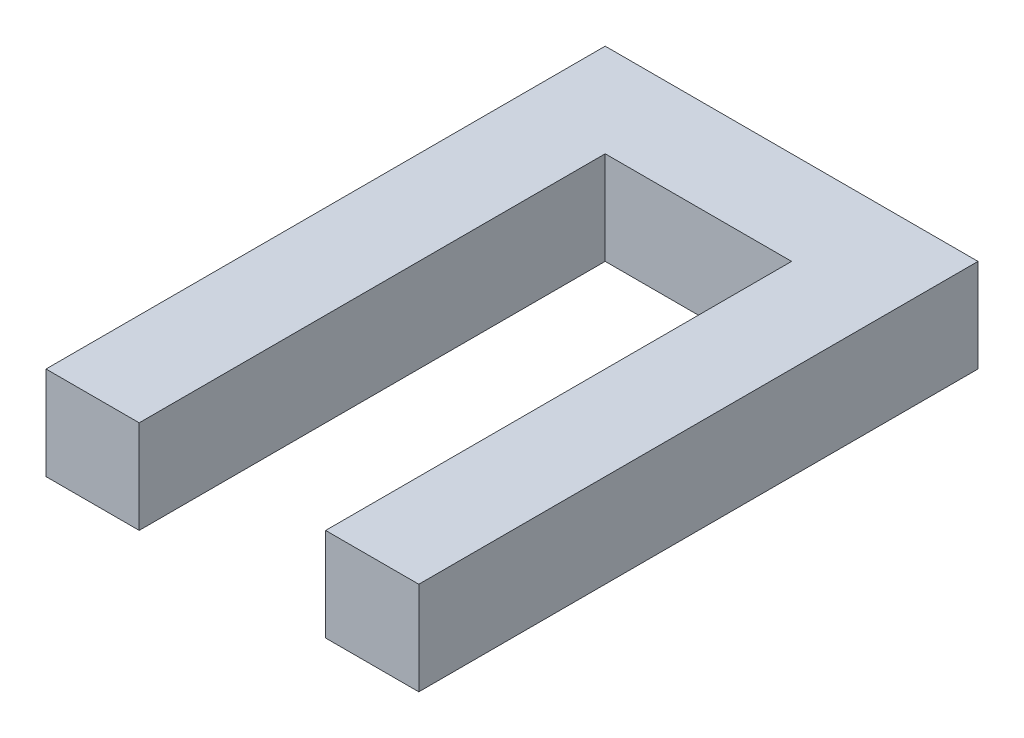
from build123d import *

# Parameters (mm, degrees)
BOSS_EXTRUDE1_DEPTH = 2


with BuildPart() as part:
    # Sketch1 → Boss-Extrude1 (new body)
    with BuildSketch(Plane(origin=(0, 0, 0), x_dir=(1, 0, 0), z_dir=(0, 1, 0))):
        Polygon((2, 4), (2, -6), (4, -6), (4, 6), (-4, 6), (-4, -6), (-2, -6), (-2, 4), align=None)
    extrude(amount=BOSS_EXTRUDE1_DEPTH)


solid = part.part
